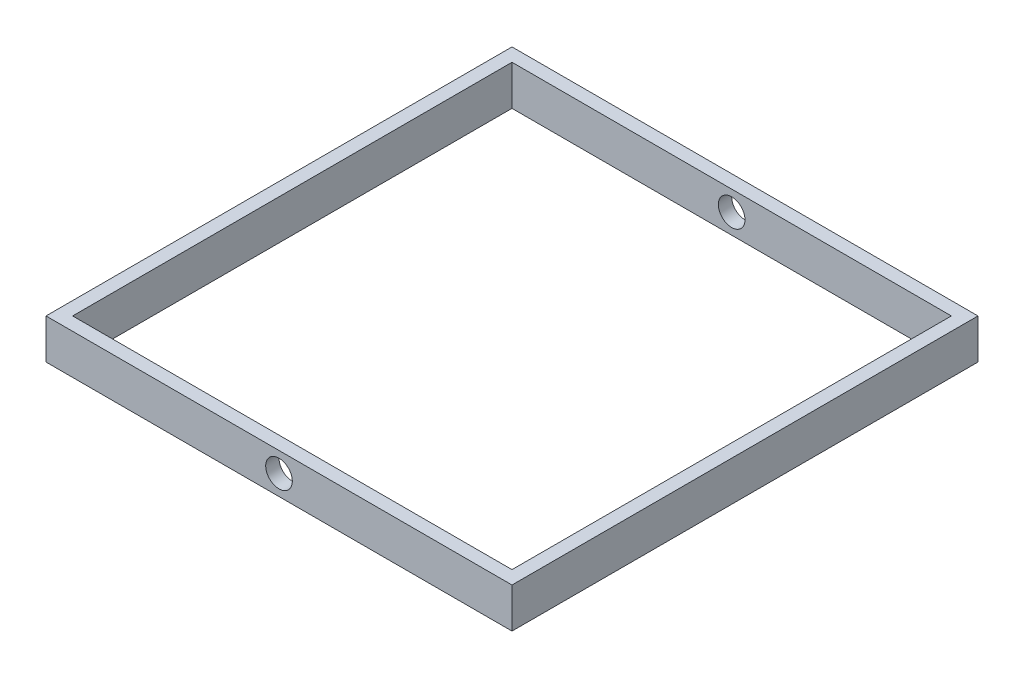
from build123d import *

# Parameters (mm, degrees)
SKETCH1_W           = 175
SKETCH1_H           = 175
BOSS_EXTRUDE1_DEPTH = 15
SKETCH2_W           = 165
SKETCH2_H           = 165
CUT_EXTRUDE1_DEPTH  = 15
SKETCH3_R           = 5
CUT_EXTRUDE2_DEPTH  = 197.230094532


with BuildPart() as part:
    # Sketch1 → Boss-Extrude1 (new body)
    with BuildSketch(Plane(origin=(0, 0, 0), x_dir=(1, 0, 0), z_dir=(0, 1, 0))):
        Rectangle(SKETCH1_W, SKETCH1_H)
    extrude(amount=BOSS_EXTRUDE1_DEPTH)

    # Sketch2 → Cut-Extrude1 (cut)
    with BuildSketch(Plane(origin=(0, 15, 0), x_dir=(1, 0, 0), z_dir=(0, 1, 0))):
        Rectangle(SKETCH2_W, SKETCH2_H)
    extrude(amount=-CUT_EXTRUDE1_DEPTH, mode=Mode.SUBTRACT)

    # Sketch3 → Cut-Extrude2 (cut, through all)
    with BuildSketch(Plane.XY.offset(87.5)):
        with Locations((0, 7.5)):
            Circle(SKETCH3_R)
    extrude(amount=-CUT_EXTRUDE2_DEPTH, mode=Mode.SUBTRACT)


solid = part.part
